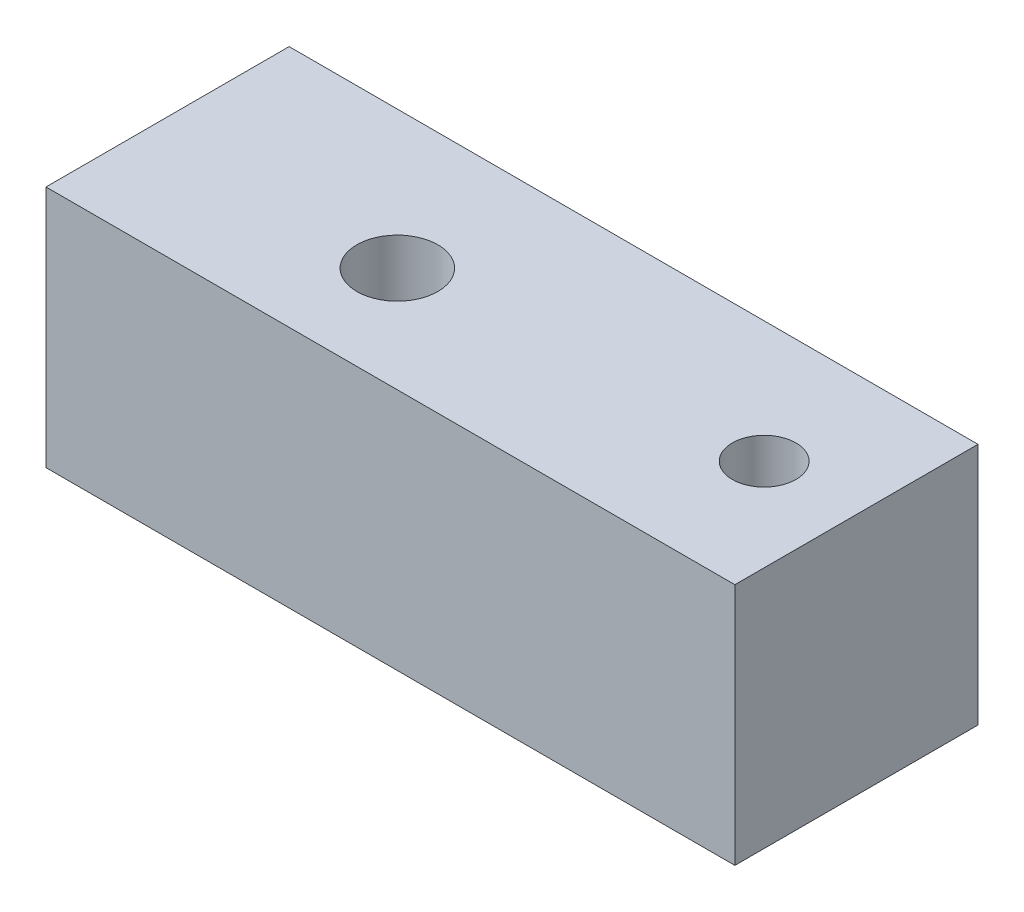
from build123d import *

# Parameters (mm, degrees)
SKETCH2_W                   = 53.975
SKETCH2_H                   = 19.05
BOSS_EXTRUDE1_DEPTH         = 19.05
F_1_4_0_25_DIAMETER_HOLE1_D = 6.35


with BuildPart() as part:
    # Sketch2 → Boss-Extrude1 (new body)
    with BuildSketch(Plane.XY):
        with Locations((210.84694204, -3.175)):
            Rectangle(SKETCH2_W, SKETCH2_H)
    extrude(amount=BOSS_EXTRUDE1_DEPTH)

    # 1/4 (0.25) Diameter Hole1 (through all)
    with Locations(Plane(origin=(0, 6.35, 0), x_dir=(1, 0, 0), z_dir=(0, 1, 0))):
        with Locations((203.133359856, -10.795)):
            Hole(F_1_4_0_25_DIAMETER_HOLE1_D / 2)

    # Sketch10 → #10 Clearance Hole1 (revolve, cut)
    with BuildSketch(Plane(origin=(230.602380141, 6.35, 9.525), x_dir=(0, 0, 1), z_dir=(1, 0, 0))):
        Polygon((0, 0), (0, 19.05), (5.2197, 19.05), (2.4892, 15.908919064), (2.4892, 0), align=None)
    revolve(axis=Axis((230.602380141, 12.7, 9.525), (0, -1, 0)), mode=Mode.SUBTRACT)


solid = part.part
